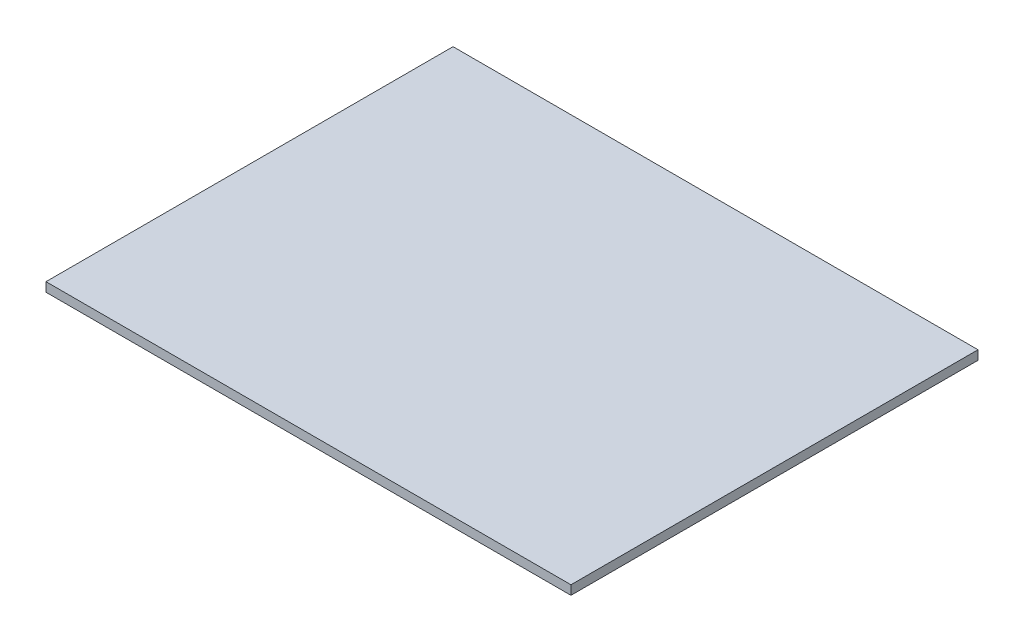
from build123d import *

# Parameters (mm, degrees)
SKETCH1_W           = 263.3434916
SKETCH1_H           = 204.19140391
BOSS_EXTRUDE1_DEPTH = 4.599999944


with BuildPart() as part:
    # Sketch1 → Boss-Extrude1 (new body)
    with BuildSketch(Plane(origin=(0, 0, 0), x_dir=(1, 0, 0), z_dir=(0, 1, 0))):
        with Locations((131.6717458, 102.095701955)):
            Rectangle(SKETCH1_W, SKETCH1_H)
    extrude(amount=BOSS_EXTRUDE1_DEPTH)


solid = part.part
